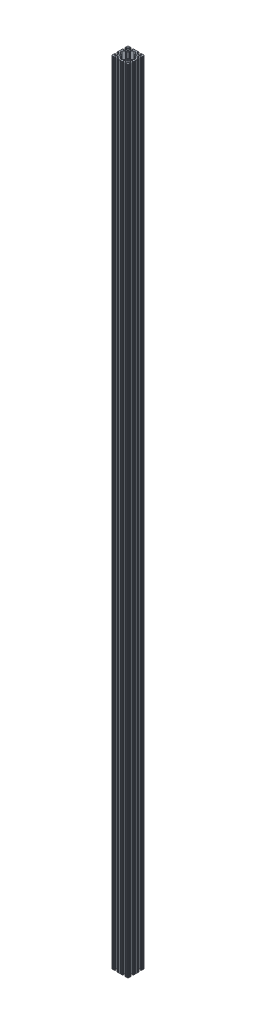
from build123d import *

# Parameters (mm, degrees)
SCHIZZO1_R                   = 2.62
ESTRUSIONE_ESTRUSIONE1_DEPTH = 2900


with BuildPart() as part:
    # Schizzo1 → Estrusione-Estrusione1 (new body)
    with BuildSketch(Plane.XZ):
        with BuildLine():
            Line((10.4, 0), (8.4, 0))
            ThreePointArc((8.4, 0), (8, -0.4), (7.6, 0))
            Line((7.6, 0), (3, 0))
            ThreePointArc((3, 0), (2.6, -0.4), (2.2, 0))
            Line((2.2, 0), (2, 0))
            ThreePointArc((2, 0), (0.585786438, -0.585786438), (0, -2))
            Line((0, -2), (0, -2.2))
            ThreePointArc((0, -2.2), (0.4, -2.6), (0, -3))
            Line((0, -3), (0, -7.6))
            ThreePointArc((0, -7.6), (0.4, -8), (0, -8.4))
            Line((0, -8.4), (0, -10.4))
            ThreePointArc((0, -10.4), (0.410050506, -11.389949494), (1.4, -11.8))
            Line((1.4, -11.8), (1.8, -11.8))
            ThreePointArc((1.8, -11.8), (2.789949494, -11.389949494), (3.2, -10.4))
            Line((3.2, -10.4), (3.2, -7.35411255))
            ThreePointArc((3.2, -7.35411255), (3.693853254, -6.615008924), (4.565685425, -6.788427125))
            Line((4.565685425, -6.788427125), (8.954213562, -11.176955262))
            ThreePointArc((8.954213562, -11.176955262), (9.387759065, -11.82580196), (9.54, -12.591168825))
            Line((9.54, -12.591168825), (9.54, -17.371572875))
            ThreePointArc((9.54, -17.371572875), (9.387759065, -18.13693974), (8.954213562, -18.785786438))
            Line((8.954213562, -18.785786438), (4.565685425, -23.174314575))
            ThreePointArc((4.565685425, -23.174314575), (3.693853254, -23.347732776), (3.2, -22.60862915))
            Line((3.2, -22.60862915), (3.2, -19.6))
            ThreePointArc((3.2, -19.6), (2.789949494, -18.610050506), (1.8, -18.2))
            Line((1.8, -18.2), (1.4, -18.2))
            ThreePointArc((1.4, -18.2), (0.410050506, -18.610050506), (0, -19.6))
            Line((0, -19.6), (0, -20.4))
            ThreePointArc((0, -20.4), (0.4, -20.8), (0, -21.2))
            Line((0, -21.2), (0, -25.8))
            ThreePointArc((0, -25.8), (0.4, -26.2), (0, -26.6))
            Line((0, -26.6), (0, -33.4))
            ThreePointArc((0, -33.4), (0.4, -33.8), (0, -34.2))
            Line((0, -34.2), (0, -38.8))
            ThreePointArc((0, -38.8), (0.4, -39.2), (0, -39.6))
            Line((0, -39.6), (0, -40.4))
            ThreePointArc((0, -40.4), (0.410050506, -41.389949494), (1.4, -41.8))
            Line((1.4, -41.8), (1.8, -41.8))
            ThreePointArc((1.8, -41.8), (2.789949494, -41.389949494), (3.2, -40.4))
            Line((3.2, -40.4), (3.2, -37.39137085))
            ThreePointArc((3.2, -37.39137085), (3.693853254, -36.652267224), (4.565685425, -36.825685425))
            Line((4.565685425, -36.825685425), (8.954213562, -41.214213562))
            ThreePointArc((8.954213562, -41.214213562), (9.387759065, -41.86306026), (9.54, -42.628427125))
            Line((9.54, -42.628427125), (9.54, -47.408831175))
            ThreePointArc((9.54, -47.408831175), (9.387759065, -48.17419804), (8.954213562, -48.823044738))
            Line((8.954213562, -48.823044738), (4.565685425, -53.211572875))
            ThreePointArc((4.565685425, -53.211572875), (3.693853254, -53.384991076), (3.2, -52.64588745))
            Line((3.2, -52.64588745), (3.2, -49.6))
            ThreePointArc((3.2, -49.6), (2.789949494, -48.610050506), (1.8, -48.2))
            Line((1.8, -48.2), (1.4, -48.2))
            ThreePointArc((1.4, -48.2), (0.410050506, -48.610050506), (0, -49.6))
            Line((0, -49.6), (0, -51.6))
            ThreePointArc((0, -51.6), (0.4, -52), (0, -52.4))
            Line((0, -52.4), (0, -57))
            ThreePointArc((0, -57), (0.4, -57.4), (0, -57.8))
            Line((0, -57.8), (0, -58))
            ThreePointArc((0, -58), (0.585786438, -59.414213562), (2, -60))
            Line((2, -60), (2.2, -60))
            ThreePointArc((2.2, -60), (2.6, -59.6), (3, -60))
            Line((3, -60), (7.6, -60))
            ThreePointArc((7.6, -60), (8, -59.6), (8.4, -60))
            Line((8.4, -60), (10.4, -60))
            ThreePointArc((10.4, -60), (11.389949494, -59.589949494), (11.8, -58.6))
            Line((11.8, -58.6), (11.8, -58.2))
            ThreePointArc((11.8, -58.2), (11.389949494, -57.210050506), (10.4, -56.8))
            Line((10.4, -56.8), (7.35411255, -56.8))
            ThreePointArc((7.35411255, -56.8), (6.615008924, -56.306146746), (6.788427125, -55.434314575))
            Line((6.788427125, -55.434314575), (11.176955262, -51.045786438))
            ThreePointArc((11.176955262, -51.045786438), (11.82580196, -50.612240935), (12.591168825, -50.46))
            Line((12.591168825, -50.46), (17.371572875, -50.46))
            ThreePointArc((17.371572875, -50.46), (18.13693974, -50.612240935), (18.785786438, -51.045786438))
            Line((18.785786438, -51.045786438), (23.174314575, -55.434314575))
            ThreePointArc((23.174314575, -55.434314575), (23.347732776, -56.306146746), (22.60862915, -56.8))
            Line((22.60862915, -56.8), (19.6, -56.8))
            ThreePointArc((19.6, -56.8), (18.610050506, -57.210050506), (18.2, -58.2))
            Line((18.2, -58.2), (18.2, -58.6))
            ThreePointArc((18.2, -58.6), (18.610050506, -59.589949494), (19.6, -60))
            Line((19.6, -60), (20.4, -60))
            ThreePointArc((20.4, -60), (20.8, -59.6), (21.2, -60))
            Line((21.2, -60), (25.8, -60))
            ThreePointArc((25.8, -60), (26.2, -59.6), (26.6, -60))
            Line((26.6, -60), (33.4, -60))
            ThreePointArc((33.4, -60), (33.8, -59.6), (34.2, -60))
            Line((34.2, -60), (38.8, -60))
            ThreePointArc((38.8, -60), (39.2, -59.6), (39.6, -60))
            Line((39.6, -60), (40.4, -60))
            ThreePointArc((40.4, -60), (41.389949494, -59.589949494), (41.8, -58.6))
            Line((41.8, -58.6), (41.8, -58.2))
            ThreePointArc((41.8, -58.2), (41.389949494, -57.210050506), (40.4, -56.8))
            Line((40.4, -56.8), (37.39137085, -56.8))
            ThreePointArc((37.39137085, -56.8), (36.652267224, -56.306146746), (36.825685425, -55.434314575))
            Line((36.825685425, -55.434314575), (41.214213562, -51.045786438))
            ThreePointArc((41.214213562, -51.045786438), (41.86306026, -50.612240935), (42.628427125, -50.46))
            Line((42.628427125, -50.46), (47.408831175, -50.46))
            ThreePointArc((47.408831175, -50.46), (48.17419804, -50.612240935), (48.823044738, -51.045786438))
            Line((48.823044738, -51.045786438), (53.211572875, -55.434314575))
            ThreePointArc((53.211572875, -55.434314575), (53.384991076, -56.306146746), (52.64588745, -56.8))
            Line((52.64588745, -56.8), (49.6, -56.8))
            ThreePointArc((49.6, -56.8), (48.610050506, -57.210050506), (48.2, -58.2))
            Line((48.2, -58.2), (48.2, -58.6))
            ThreePointArc((48.2, -58.6), (48.610050506, -59.589949494), (49.6, -60))
            Line((49.6, -60), (51.6, -60))
            ThreePointArc((51.6, -60), (52, -59.6), (52.4, -60))
            Line((52.4, -60), (57, -60))
            ThreePointArc((57, -60), (57.4, -59.6), (57.8, -60))
            Line((57.8, -60), (58, -60))
            ThreePointArc((58, -60), (59.414213562, -59.414213562), (60, -58))
            Line((60, -58), (60, -57.8))
            ThreePointArc((60, -57.8), (59.6, -57.4), (60, -57))
            Line((60, -57), (60, -52.4))
            ThreePointArc((60, -52.4), (59.6, -52), (60, -51.6))
            Line((60, -51.6), (60, -49.6))
            ThreePointArc((60, -49.6), (59.589949494, -48.610050506), (58.6, -48.2))
            Line((58.6, -48.2), (58.2, -48.2))
            ThreePointArc((58.2, -48.2), (57.210050506, -48.610050506), (56.8, -49.6))
            Line((56.8, -49.6), (56.8, -52.64588745))
            ThreePointArc((56.8, -52.64588745), (56.306146746, -53.384991076), (55.434314575, -53.211572875))
            Line((55.434314575, -53.211572875), (51.045786438, -48.823044738))
            ThreePointArc((51.045786438, -48.823044738), (50.612240935, -48.17419804), (50.46, -47.408831175))
            Line((50.46, -47.408831175), (50.46, -42.628427125))
            ThreePointArc((50.46, -42.628427125), (50.612240935, -41.86306026), (51.045786438, -41.214213562))
            Line((51.045786438, -41.214213562), (55.434314575, -36.825685425))
            ThreePointArc((55.434314575, -36.825685425), (56.306146746, -36.652267224), (56.8, -37.39137085))
            Line((56.8, -37.39137085), (56.8, -40.4))
            ThreePointArc((56.8, -40.4), (57.210050506, -41.389949494), (58.2, -41.8))
            Line((58.2, -41.8), (58.6, -41.8))
            ThreePointArc((58.6, -41.8), (59.589949494, -41.389949494), (60, -40.4))
            Line((60, -40.4), (60, -39.6))
            ThreePointArc((60, -39.6), (59.6, -39.2), (60, -38.8))
            Line((60, -38.8), (60, -34.2))
            ThreePointArc((60, -34.2), (59.6, -33.8), (60, -33.4))
            Line((60, -33.4), (60, -26.6))
            ThreePointArc((60, -26.6), (59.6, -26.2), (60, -25.8))
            Line((60, -25.8), (60, -21.2))
            ThreePointArc((60, -21.2), (59.6, -20.8), (60, -20.4))
            Line((60, -20.4), (60, -19.6))
            ThreePointArc((60, -19.6), (59.589949494, -18.610050506), (58.6, -18.2))
            Line((58.6, -18.2), (58.2, -18.2))
            ThreePointArc((58.2, -18.2), (57.210050506, -18.610050506), (56.8, -19.6))
            Line((56.8, -19.6), (56.8, -22.60862915))
            ThreePointArc((56.8, -22.60862915), (56.306146746, -23.347732776), (55.434314575, -23.174314575))
            Line((55.434314575, -23.174314575), (51.045786438, -18.785786438))
            ThreePointArc((51.045786438, -18.785786438), (50.612240935, -18.13693974), (50.46, -17.371572875))
            Line((50.46, -17.371572875), (50.46, -12.591168825))
            ThreePointArc((50.46, -12.591168825), (50.612240935, -11.82580196), (51.045786438, -11.176955262))
            Line((51.045786438, -11.176955262), (55.434314575, -6.788427125))
            ThreePointArc((55.434314575, -6.788427125), (56.306146746, -6.615008924), (56.8, -7.35411255))
            Line((56.8, -7.35411255), (56.8, -10.4))
            ThreePointArc((56.8, -10.4), (57.210050506, -11.389949494), (58.2, -11.8))
            Line((58.2, -11.8), (58.6, -11.8))
            ThreePointArc((58.6, -11.8), (59.589949494, -11.389949494), (60, -10.4))
            Line((60, -10.4), (60, -8.4))
            ThreePointArc((60, -8.4), (59.6, -8), (60, -7.6))
            Line((60, -7.6), (60, -3))
            ThreePointArc((60, -3), (59.6, -2.6), (60, -2.2))
            Line((60, -2.2), (60, -2))
            ThreePointArc((60, -2), (59.414213562, -0.585786438), (58, 0))
            Line((58, 0), (57.8, 0))
            ThreePointArc((57.8, 0), (57.4, -0.4), (57, 0))
            Line((57, 0), (52.4, 0))
            ThreePointArc((52.4, 0), (52, -0.4), (51.6, 0))
            Line((51.6, 0), (49.6, 0))
            ThreePointArc((49.6, 0), (48.610050506, -0.410050506), (48.2, -1.4))
            Line((48.2, -1.4), (48.2, -1.8))
            ThreePointArc((48.2, -1.8), (48.610050506, -2.789949494), (49.6, -3.2))
            Line((49.6, -3.2), (52.64588745, -3.2))
            ThreePointArc((52.64588745, -3.2), (53.384991076, -3.693853254), (53.211572875, -4.565685425))
            Line((53.211572875, -4.565685425), (48.823044738, -8.954213562))
            ThreePointArc((48.823044738, -8.954213562), (48.17419804, -9.387759065), (47.408831175, -9.54))
            Line((47.408831175, -9.54), (42.628427125, -9.54))
            ThreePointArc((42.628427125, -9.54), (41.86306026, -9.387759065), (41.214213562, -8.954213562))
            Line((41.214213562, -8.954213562), (36.825685425, -4.565685425))
            ThreePointArc((36.825685425, -4.565685425), (36.652267224, -3.693853254), (37.39137085, -3.2))
            Line((37.39137085, -3.2), (40.4, -3.2))
            ThreePointArc((40.4, -3.2), (41.389949494, -2.789949494), (41.8, -1.8))
            Line((41.8, -1.8), (41.8, -1.4))
            ThreePointArc((41.8, -1.4), (41.389949494, -0.410050506), (40.4, 0))
            Line((40.4, 0), (39.6, 0))
            ThreePointArc((39.6, 0), (39.2, -0.4), (38.8, 0))
            Line((38.8, 0), (34.2, 0))
            ThreePointArc((34.2, 0), (33.8, -0.4), (33.4, 0))
            Line((33.4, 0), (26.6, 0))
            ThreePointArc((26.6, 0), (26.2, -0.4), (25.8, 0))
            Line((25.8, 0), (21.2, 0))
            ThreePointArc((21.2, 0), (20.8, -0.4), (20.4, 0))
            Line((20.4, 0), (19.6, 0))
            ThreePointArc((19.6, 0), (18.610050506, -0.410050506), (18.2, -1.4))
            Line((18.2, -1.4), (18.2, -1.8))
            ThreePointArc((18.2, -1.8), (18.610050506, -2.789949494), (19.6, -3.2))
            Line((19.6, -3.2), (22.60862915, -3.2))
            ThreePointArc((22.60862915, -3.2), (23.347732776, -3.693853254), (23.174314575, -4.565685425))
            Line((23.174314575, -4.565685425), (18.785786438, -8.954213562))
            ThreePointArc((18.785786438, -8.954213562), (18.13693974, -9.387759065), (17.371572875, -9.54))
            Line((17.371572875, -9.54), (12.591168825, -9.54))
            ThreePointArc((12.591168825, -9.54), (11.82580196, -9.387759065), (11.176955262, -8.954213562))
            Line((11.176955262, -8.954213562), (6.788427125, -4.565685425))
            ThreePointArc((6.788427125, -4.565685425), (6.615008924, -3.693853254), (7.35411255, -3.2))
            Line((7.35411255, -3.2), (10.4, -3.2))
            ThreePointArc((10.4, -3.2), (11.389949494, -2.789949494), (11.8, -1.8))
            Line((11.8, -1.8), (11.8, -1.4))
            ThreePointArc((11.8, -1.4), (11.389949494, -0.410050506), (10.4, 0))
        make_face()
        with Locations(Location((15.003749624, -15.003749624, 0), (0, 0, 90))):
            Circle(SCHIZZO1_R, mode=Mode.SUBTRACT)
        with Locations(Location((44.996250376, -15.003749624, 0), (0, 0, 90))):
            Circle(SCHIZZO1_R, mode=Mode.SUBTRACT)
        with Locations(Location((44.996250376, -44.996250376, 0), (0, 0, 90))):
            Circle(SCHIZZO1_R, mode=Mode.SUBTRACT)
        with Locations(Location((15.003749624, -44.996250376, 0), (0, 0, 90))):
            Circle(SCHIZZO1_R, mode=Mode.SUBTRACT)
        with BuildLine():
            Line((16.503749624, -39.496250376), (13.5246775, -39.496250376))
            ThreePointArc((13.5246775, -39.496250376), (12.759310636, -39.344009441), (12.110463938, -38.910463938))
            Line((12.110463938, -38.910463938), (6.028427125, -32.828427125))
            ThreePointArc((6.028427125, -32.828427125), (4.856854249, -30), (6.028427125, -27.171572875))
            Line((6.028427125, -27.171572875), (12.110463938, -21.089536062))
            ThreePointArc((12.110463938, -21.089536062), (12.759310636, -20.655990559), (13.5246775, -20.503749624))
            Line((13.5246775, -20.503749624), (16.503749624, -20.503749624))
            ThreePointArc((16.503749624, -20.503749624), (19.332176749, -19.332176749), (20.503749624, -16.503749624))
            Line((20.503749624, -16.503749624), (20.503749624, -13.5246775))
            ThreePointArc((20.503749624, -13.5246775), (20.655990559, -12.759310636), (21.089536062, -12.110463938))
            Line((21.089536062, -12.110463938), (27.171572875, -6.028427125))
            ThreePointArc((27.171572875, -6.028427125), (30, -4.856854249), (32.828427125, -6.028427125))
            Line((32.828427125, -6.028427125), (38.910463938, -12.110463938))
            ThreePointArc((38.910463938, -12.110463938), (39.344009441, -12.759310636), (39.496250376, -13.5246775))
            Line((39.496250376, -13.5246775), (39.496250376, -16.503749624))
            ThreePointArc((39.496250376, -16.503749624), (40.667823251, -19.332176749), (43.496250376, -20.503749624))
            Line((43.496250376, -20.503749624), (46.4753225, -20.503749624))
            ThreePointArc((46.4753225, -20.503749624), (47.240689364, -20.655990559), (47.889536062, -21.089536062))
            Line((47.889536062, -21.089536062), (53.971572875, -27.171572875))
            ThreePointArc((53.971572875, -27.171572875), (55.143145751, -30), (53.971572875, -32.828427125))
            Line((53.971572875, -32.828427125), (47.889536062, -38.910463938))
            ThreePointArc((47.889536062, -38.910463938), (47.240689364, -39.344009441), (46.4753225, -39.496250376))
            Line((46.4753225, -39.496250376), (43.496250376, -39.496250376))
            ThreePointArc((43.496250376, -39.496250376), (40.667823251, -40.667823251), (39.496250376, -43.496250376))
            Line((39.496250376, -43.496250376), (39.496250376, -46.4753225))
            ThreePointArc((39.496250376, -46.4753225), (39.344009441, -47.240689364), (38.910463938, -47.889536062))
            Line((38.910463938, -47.889536062), (32.828427125, -53.971572875))
            ThreePointArc((32.828427125, -53.971572875), (30, -55.143145751), (27.171572875, -53.971572875))
            Line((27.171572875, -53.971572875), (21.089536062, -47.889536062))
            ThreePointArc((21.089536062, -47.889536062), (20.655990559, -47.240689364), (20.503749624, -46.4753225))
            Line((20.503749624, -46.4753225), (20.503749624, -43.496250376))
            ThreePointArc((20.503749624, -43.496250376), (19.332176749, -40.667823251), (16.503749624, -39.496250376))
        make_face(mode=Mode.SUBTRACT)
    extrude(amount=-ESTRUSIONE_ESTRUSIONE1_DEPTH)


solid = part.part
